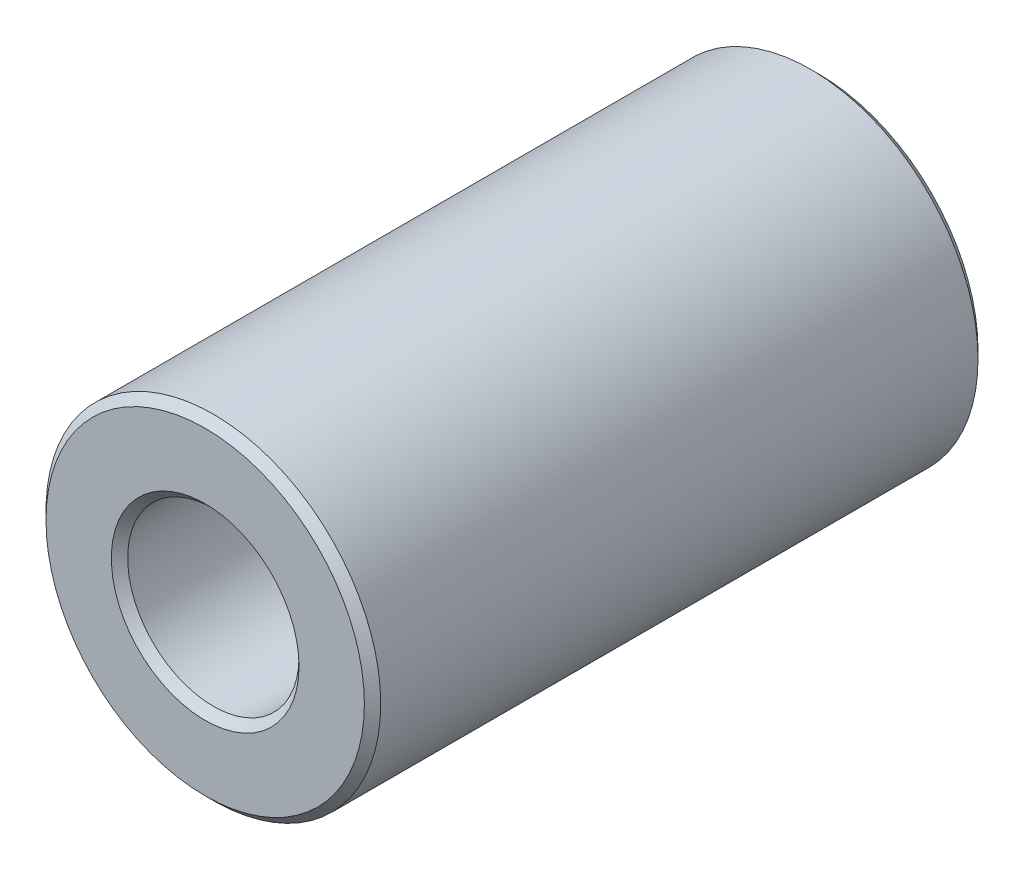
from build123d import *

# Parameters (mm, degrees)
BOSS_EXTRUDE1_DEPTH      = 8.73125
BOSS_EXTRUDE1_DEPTH_BACK = 8.73125
SKETCH3_R                = 4.7625
SKETCH3_R_2              = 2.4384
CHAMFER1_SIZE            = 0.23241


with BuildPart() as part:
    # Sketch3 → Boss-Extrude1 (new, two sides: drawn at the far end of the back side and taken through both)
    with BuildSketch(Plane.XY.offset(-BOSS_EXTRUDE1_DEPTH_BACK)):
        Circle(SKETCH3_R)
        Circle(SKETCH3_R_2, mode=Mode.SUBTRACT)
    extrude(amount=BOSS_EXTRUDE1_DEPTH + BOSS_EXTRUDE1_DEPTH_BACK)

    # Chamfer1
    chamfer1_edges = [part.edges().sort_by_distance(p)[0] for p in [
        (-4.7625, 0, -8.73125),
        (-2.4384, 0, -8.73125),
        (-4.7625, 0, 8.73125),
        (-2.4384, 0, 8.73125),
    ]]
    chamfer(chamfer1_edges, length=CHAMFER1_SIZE)


solid = part.part
